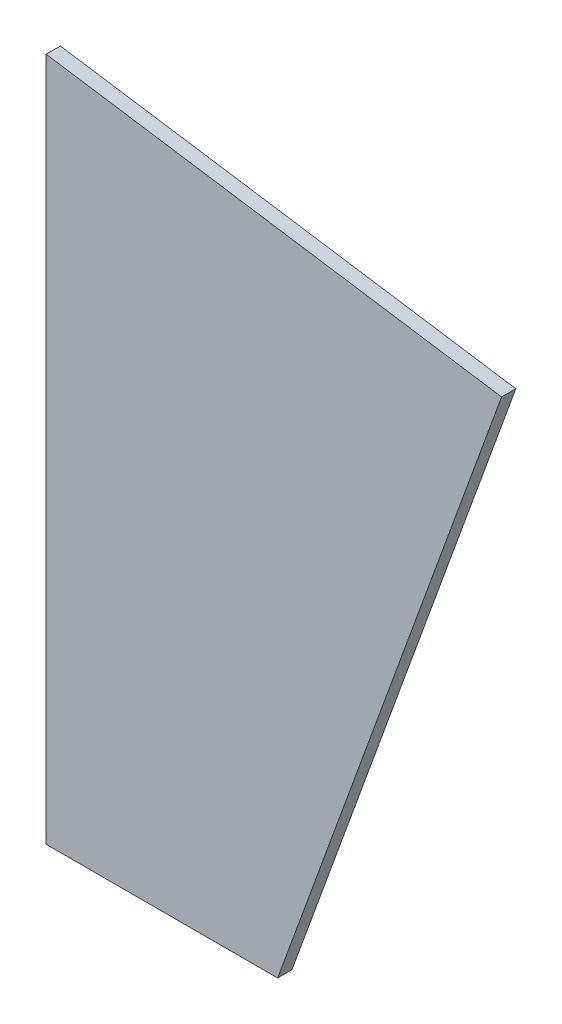
from build123d import *

# Parameters (mm, degrees)
BOSS_EXTRUDE1_DEPTH = 3.175


with BuildPart() as part:
    # Sketch1 → Boss-Extrude1 (new body)
    with BuildSketch(Plane.XY):
        Polygon((0, 0), (0, 152.4), (101.427168816, 137.00342534), (51.562, 0), align=None)
    extrude(amount=BOSS_EXTRUDE1_DEPTH)


solid = part.part
